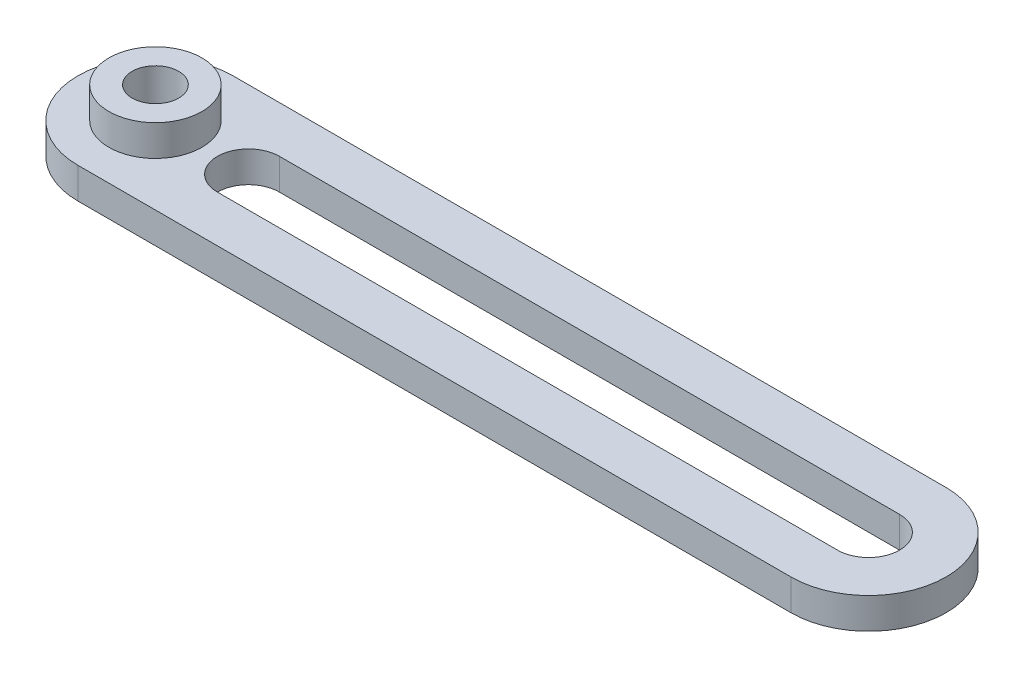
from build123d import *

# Parameters (mm, degrees)
SKETCH2_R           = 7.5
BOSS_EXTRUDE1_DEPTH = 10
SKETCH3_R           = 15
SKETCH3_R_2         = 7.5
BOSS_EXTRUDE2_DEPTH = 20


with BuildPart() as part:
    # Sketch2 → Boss-Extrude1 (new body)
    with BuildSketch(Plane(origin=(0, 0, 0), x_dir=(1, 0, 0), z_dir=(0, 1, 0))):
        with BuildLine():
            Line((-230, 25), (0, 25))
            ThreePointArc((0, 25), (25, 0), (0, -25))
            Line((0, -25), (-230, -25))
            ThreePointArc((-230, -25), (-255, 0), (-230, 25))
        make_face()
        with Locations(Location((-230, 0, 0), (0, 0, 270))):
            Circle(SKETCH2_R, mode=Mode.SUBTRACT)
        with BuildLine():
            Line((-190, 10), (0, 10))
            ThreePointArc((0, 10), (10, 0), (0, -10))
            Line((0, -10), (-190, -10))
            Line((-190, -10), (-200, -10))
            ThreePointArc((-200, -10), (-210, 0), (-200, 10))
            Line((-200, 10), (-190, 10))
        make_face(mode=Mode.SUBTRACT)
    extrude(amount=BOSS_EXTRUDE1_DEPTH)

    # Sketch3 → Boss-Extrude2 (add)
    with BuildSketch(Plane.XZ):
        with Locations(Location((-230, 0, 0), (0, 0, 270))):
            Circle(SKETCH3_R)
        with Locations(Location((-230, 0, 0), (0, 0, 270))):
            Circle(SKETCH3_R_2, mode=Mode.SUBTRACT)
    extrude(amount=-BOSS_EXTRUDE2_DEPTH)


solid = part.part
